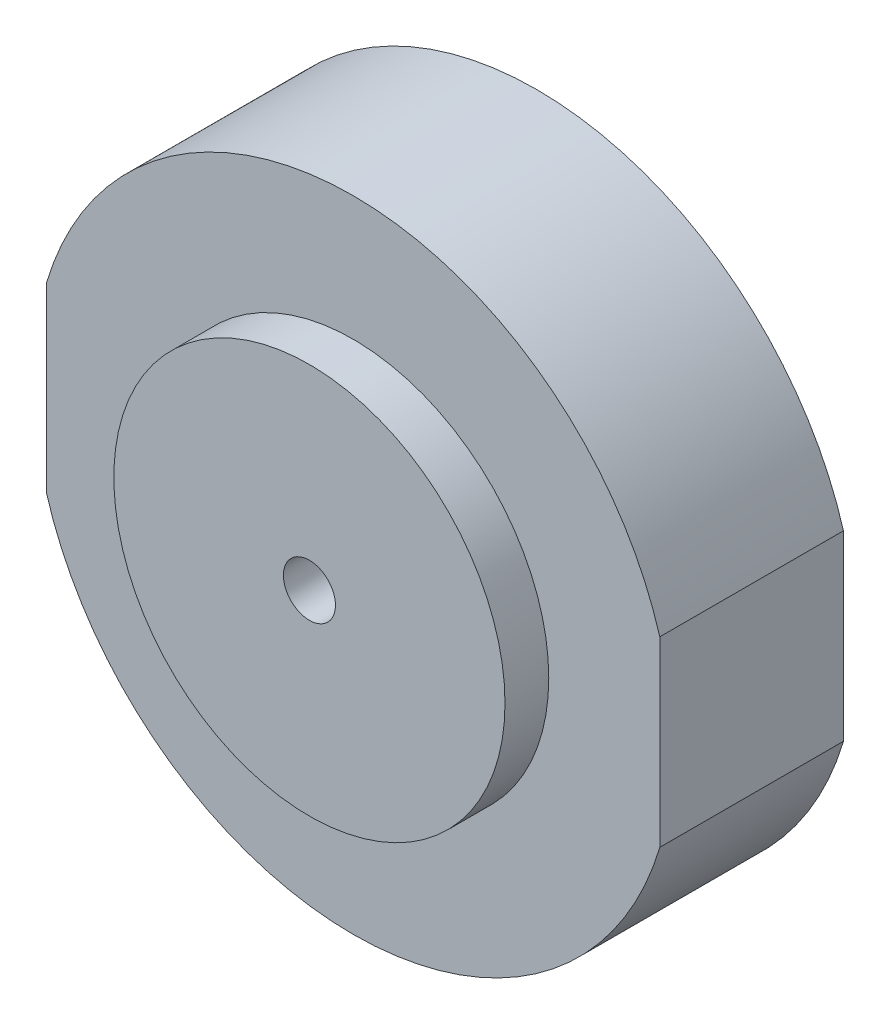
from build123d import *

# Parameters (mm, degrees)
SKETCH1_R           = 48.25
BOSS_EXTRUDE1_DEPTH = 27.7
SKETCH2_R           = 29.5
BOSS_EXTRUDE2_DEPTH = 6.6
SKETCH3_R           = 29
BOSS_EXTRUDE3_DEPTH = 8
SKETCH4_R           = 3.924903364
CUT_EXTRUDE1_DEPTH  = 8
SKETCH6_W           = 13.813607538
SKETCH6_H           = 65.464487898
SKETCH6_W_2         = 19.669375951
SKETCH6_H_2         = 76.725581
CUT_EXTRUDE2_DEPTH  = 39


with BuildPart() as part:
    # Sketch1 → Boss-Extrude1 (new body)
    with BuildSketch(Plane.XY):
        Circle(SKETCH1_R)
    extrude(amount=-BOSS_EXTRUDE1_DEPTH)

    # Sketch2 → Boss-Extrude2 (add)
    with BuildSketch(Plane.XY):
        Circle(SKETCH2_R)
    extrude(amount=BOSS_EXTRUDE2_DEPTH)

    # Sketch3 → Boss-Extrude3 (add)
    with BuildSketch(Plane(origin=(0, 0, -27.7), x_dir=(-1, 0, 0), z_dir=(0, 0, -1))):
        Circle(SKETCH3_R)
    extrude(amount=BOSS_EXTRUDE3_DEPTH)

    # Sketch4 → Cut-Extrude1 (cut)
    with BuildSketch(Plane.XY.offset(6.6)):
        Circle(SKETCH4_R)
    extrude(amount=-CUT_EXTRUDE1_DEPTH, mode=Mode.SUBTRACT)

    # Sketch6 → Cut-Extrude2 (cut)
    with BuildSketch(Plane.XY):
        with Locations((-53.156803769, 0.938424425)):
            Rectangle(SKETCH6_W, SKETCH6_H)
        with Locations((56.084687976, -0.187684885)):
            Rectangle(SKETCH6_W_2, SKETCH6_H_2)
    extrude(amount=-CUT_EXTRUDE2_DEPTH, mode=Mode.SUBTRACT)


solid = part.part
